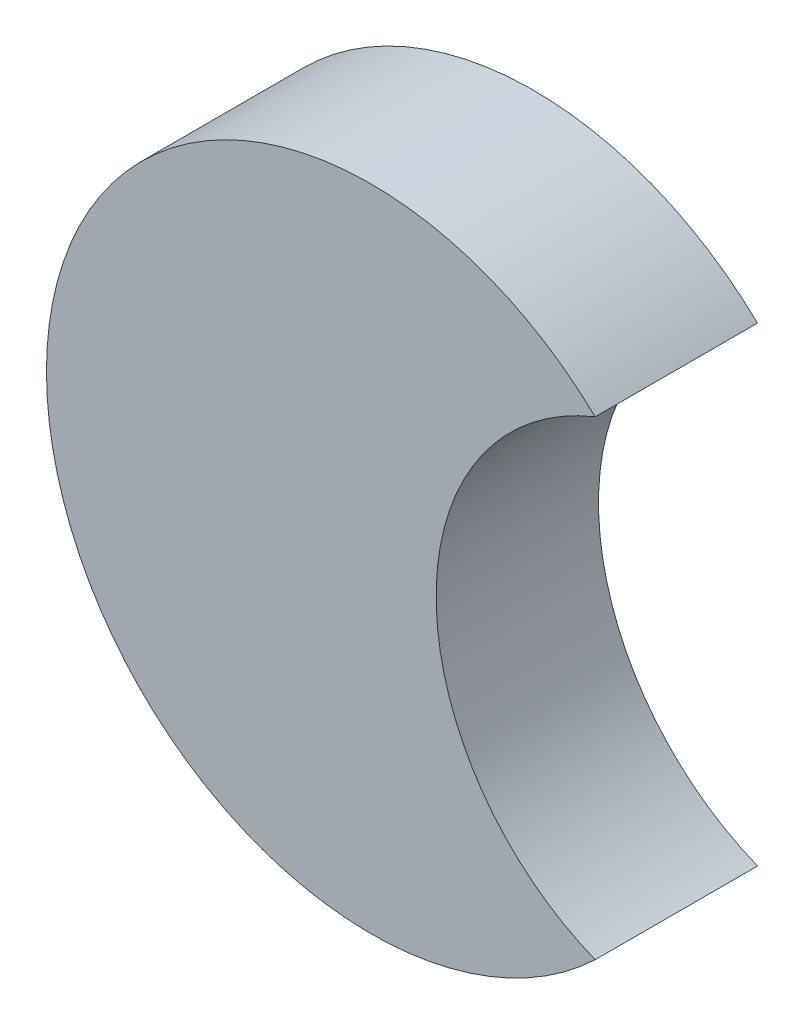
from build123d import *

# Parameters (mm, degrees)
SKETCH1_R           = 50
BOSS_EXTRUDE1_DEPTH = 25
SKETCH2_R           = 39
CUT_EXTRUDE1_DEPTH  = 25


with BuildPart() as part:
    # Sketch1 → Boss-Extrude1 (new body)
    with BuildSketch(Plane.XY):
        Circle(SKETCH1_R)
    extrude(amount=BOSS_EXTRUDE1_DEPTH)

    # Sketch2 → Cut-Extrude1 (cut)
    with BuildSketch(Plane.XY.offset(25)):
        with Locations((49, 0)):
            Circle(SKETCH2_R)
    extrude(amount=-CUT_EXTRUDE1_DEPTH, mode=Mode.SUBTRACT)


solid = part.part
